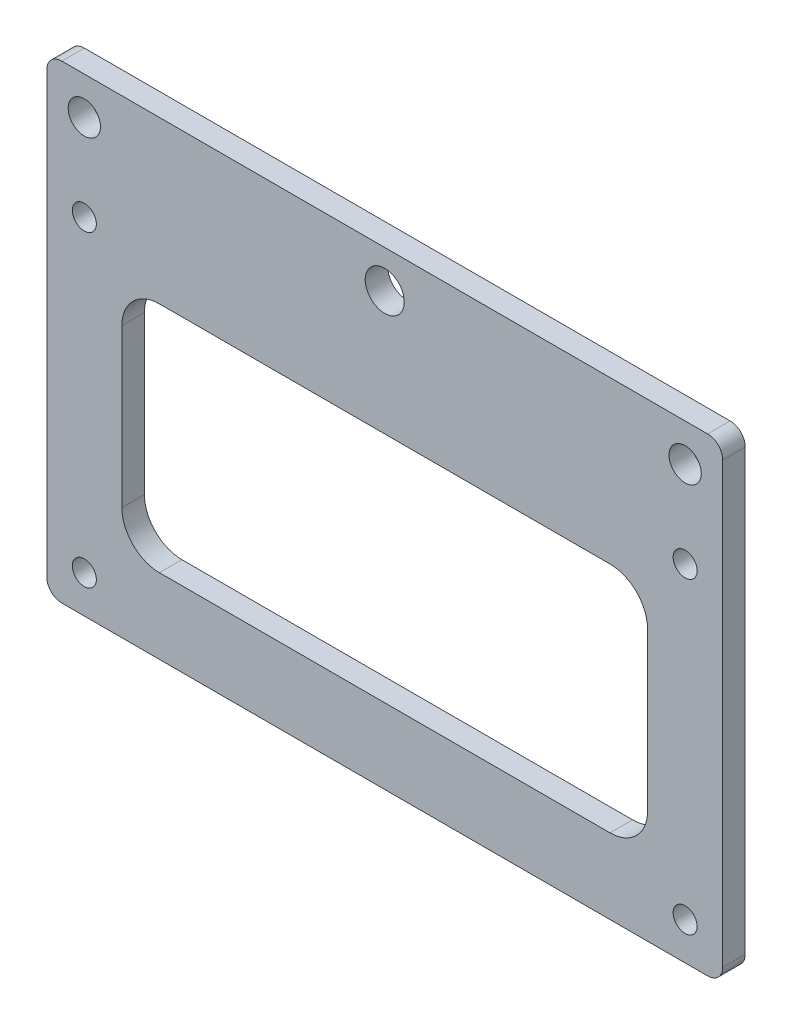
from build123d import *

# Parameters (mm, degrees)
SKETCH_1_W      = 90
SKETCH_1_H      = 62.5
SKETCH_1_R      = 1.6
SKETCH_1_R_2    = 2.15
SKETCH_1_R_3    = 2.6
SKETCH_1_W_2    = 70
SKETCH_1_H_2    = 31
EXTRUDE_1_DEPTH = 3
FILLET_1_R      = 5
FILLET_2_R      = 2


with BuildPart() as part:
    # ｽｹｯﾁ1 → ﾎﾞｽ - 押し出し1 (new body)
    with BuildSketch(Plane.XY):
        with Locations((0, 5.75)):
            Rectangle(SKETCH_1_W, SKETCH_1_H)
        with Locations((40, 20.5)):
            Circle(SKETCH_1_R, mode=Mode.SUBTRACT)
        with Locations((40, 32)):
            Circle(SKETCH_1_R_2, mode=Mode.SUBTRACT)
        with Locations(Location((-40, 32, 0), (0, 0, 180))):
            Circle(SKETCH_1_R_2, mode=Mode.SUBTRACT)
        with Locations(Location((40, -20.5, 0), (0, 0, 180))):
            Circle(SKETCH_1_R, mode=Mode.SUBTRACT)
        with Locations(Location((-40, 20.5, 0), (0, 0, 180))):
            Circle(SKETCH_1_R, mode=Mode.SUBTRACT)
        with Locations((-40, -20.5)):
            Circle(SKETCH_1_R, mode=Mode.SUBTRACT)
        with Locations((0, 32)):
            Circle(SKETCH_1_R_3, mode=Mode.SUBTRACT)
        Rectangle(SKETCH_1_W_2, SKETCH_1_H_2, mode=Mode.SUBTRACT)
    extrude(amount=EXTRUDE_1_DEPTH)

    # ﾌｨﾚｯﾄ1
    fillet_1_edges = [part.edges().sort_by_distance(p)[0] for p in [
        (-35, 15.5, 1.5),
        (-35, -15.5, 1.5),
        (35, -15.5, 1.5),
        (35, 15.5, 1.5),
    ]]
    fillet(fillet_1_edges, radius=FILLET_1_R)

    # ﾌｨﾚｯﾄ2
    fillet_2_edges = [part.edges().sort_by_distance(p)[0] for p in [
        (45, -25.5, 1.5),
        (-45, -25.5, 1.5),
        (-45, 37, 1.5),
        (45, 37, 1.5),
    ]]
    fillet(fillet_2_edges, radius=FILLET_2_R)


solid = part.part
